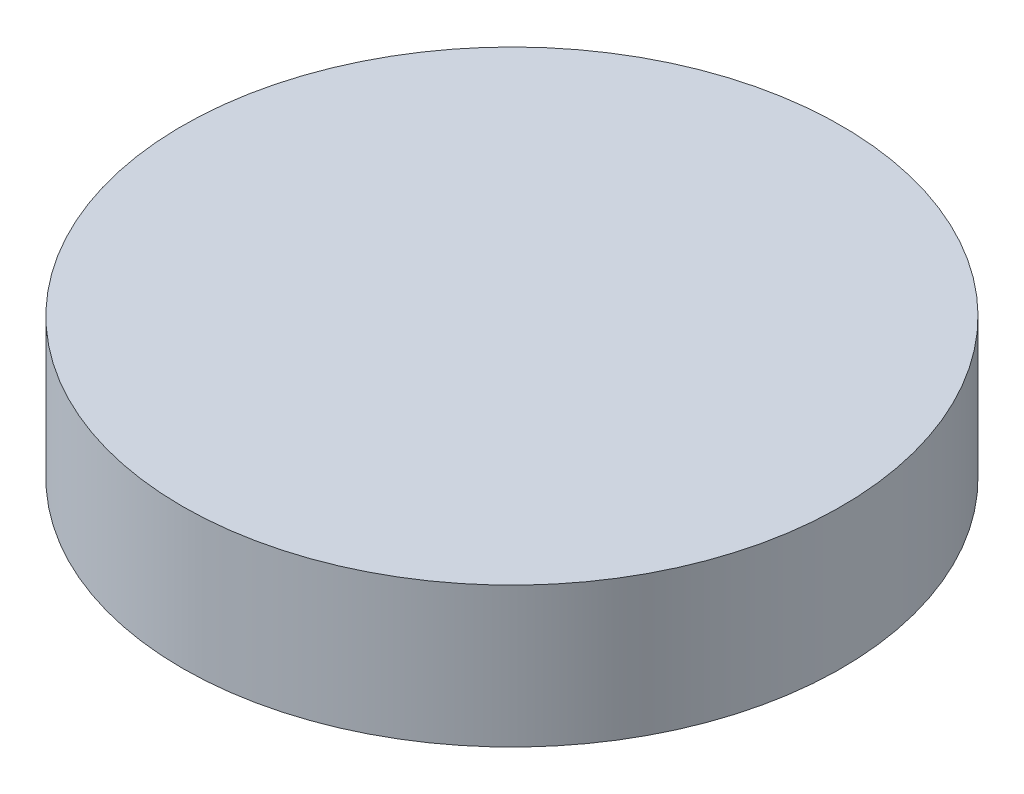
from build123d import *

# Parameters (mm, degrees)
SKETCH1_R           = 5.969
BOSS_EXTRUDE1_DEPTH = 2.54


with BuildPart() as part:
    # Sketch1 → Boss-Extrude1 (new body)
    with BuildSketch(Plane(origin=(0, 0, 0), x_dir=(1, 0, 0), z_dir=(0, 1, 0))):
        with Locations(Location((0, 0, 0), (0, 0, 270))):
            Circle(SKETCH1_R)
    extrude(amount=BOSS_EXTRUDE1_DEPTH)


solid = part.part
